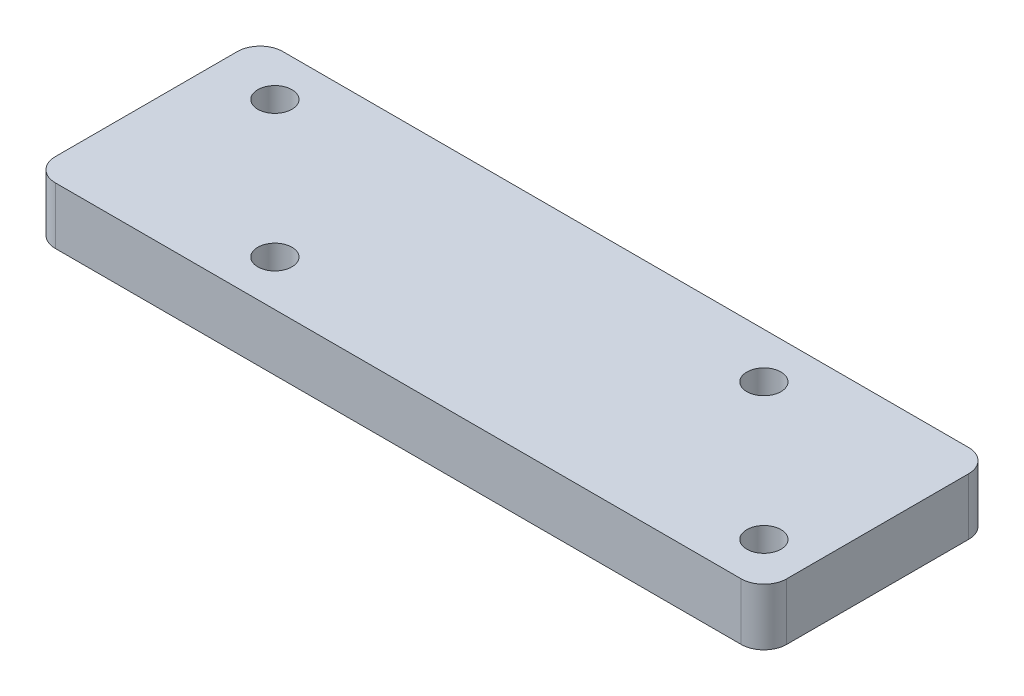
from build123d import *

# Parameters (mm, degrees)
SKETCH_1_W      = 64.3
SKETCH_1_H      = 20
SKETCH_1_R      = 1.5
EXTRUDE_1_DEPTH = 5
FILLET_1_R      = 2


with BuildPart() as part:
    # 草图1 → 凸台-拉伸1 (new body)
    with BuildSketch(Plane(origin=(0, 0, 0), x_dir=(1, 0, 0), z_dir=(0, 1, 0))):
        with Locations((32.15, 10)):
            Rectangle(SKETCH_1_W, SKETCH_1_H)
        with Locations(Location((5.3, 16, 0), (0, 0, 270))):
            Circle(SKETCH_1_R, mode=Mode.SUBTRACT)
        with Locations(Location((17.3, 4, 0), (0, 0, 270))):
            Circle(SKETCH_1_R, mode=Mode.SUBTRACT)
        with Locations(Location((48.3, 16, 0), (0, 0, 270))):
            Circle(SKETCH_1_R, mode=Mode.SUBTRACT)
        with Locations(Location((60.3, 4, 0), (0, 0, 270))):
            Circle(SKETCH_1_R, mode=Mode.SUBTRACT)
    extrude(amount=EXTRUDE_1_DEPTH)

    # 圆角1
    fillet_1_edges = [part.edges().sort_by_distance(p)[0] for p in [
        (0, 2.5, -20),
        (64.3, 2.5, -20),
        (64.3, 2.5, 0),
        (0, 2.5, 0),
    ]]
    fillet(fillet_1_edges, radius=FILLET_1_R)


solid = part.part
